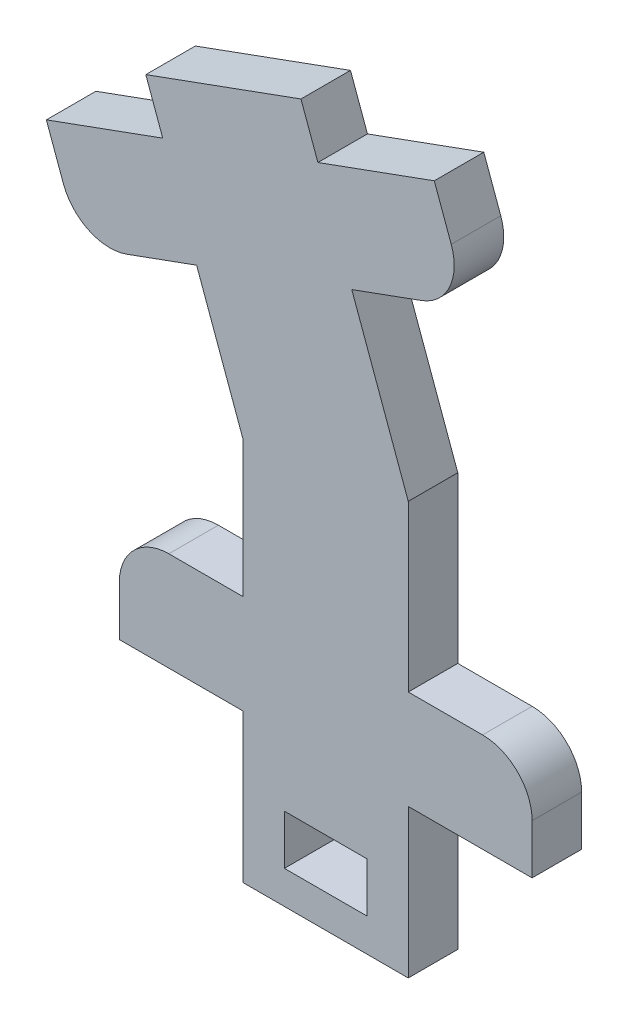
from build123d import *

# Parameters (mm, degrees)
SKETCH1_W           = 5
SKETCH1_H           = 3
BOSS_EXTRUDE1_DEPTH = 3


with BuildPart() as part:
    # Sketch1 → Boss-Extrude1 (new body)
    with BuildSketch(Plane.XY):
        with BuildLine():
            Line((0, -14.236730193), (0, -23.236730193))
            Line((0, -23.236730193), (10, -23.236730193))
            Line((10, -23.236730193), (10, -14.236730193))
            Line((10, -14.236730193), (17.5, -14.236730193))
            Line((17.5, -14.236730193), (17.5, -11.236730193))
            ThreePointArc((17.5, -11.236730193), (16.621320344, -9.115409849), (14.5, -8.236730193))
            Line((14.5, -8.236730193), (10, -8.236730193))
            Line((10, -8.236730193), (10, 1.763269807))
            Line((10, 1.763269807), (6.579798567, 11.160196015))
            Line((6.579798567, 11.160196015), (10.80841536, 12.69928666))
            ThreePointArc((10.80841536, 12.69928666), (12.501278291, 14.250509737), (12.601432793, 16.544424952))
            Line((12.601432793, 16.544424952), (11.575372363, 19.363502815))
            Line((11.575372363, 19.363502815), (4.527677707, 16.79835174))
            Line((4.527677707, 16.79835174), (3.501617277, 19.617429602))
            Line((3.501617277, 19.617429602), (-5.895308931, 16.197228169))
            Line((-5.895308931, 16.197228169), (-4.869248501, 13.378150306))
            Line((-4.869248501, 13.378150306), (-11.916943157, 10.812999231))
            Line((-11.916943157, 10.812999231), (-10.890882727, 7.993921369))
            ThreePointArc((-10.890882727, 7.993921369), (-9.33965965, 6.301058438), (-7.045744435, 6.200903937))
            Line((-7.045744435, 6.200903937), (-2.817127641, 7.739994582))
            Line((-2.817127641, 7.739994582), (0, 0))
            Line((0, 0), (0, -8.236730193))
            Line((0, -8.236730193), (-4.5, -8.236730193))
            ThreePointArc((-4.5, -8.236730193), (-6.621320344, -9.115409849), (-7.5, -11.236730193))
            Line((-7.5, -11.236730193), (-7.5, -14.236730193))
            Line((-7.5, -14.236730193), (0, -14.236730193))
        make_face()
        with Locations((5, -19.736730193)):
            Rectangle(SKETCH1_W, SKETCH1_H, mode=Mode.SUBTRACT)
    extrude(amount=BOSS_EXTRUDE1_DEPTH)


solid = part.part
